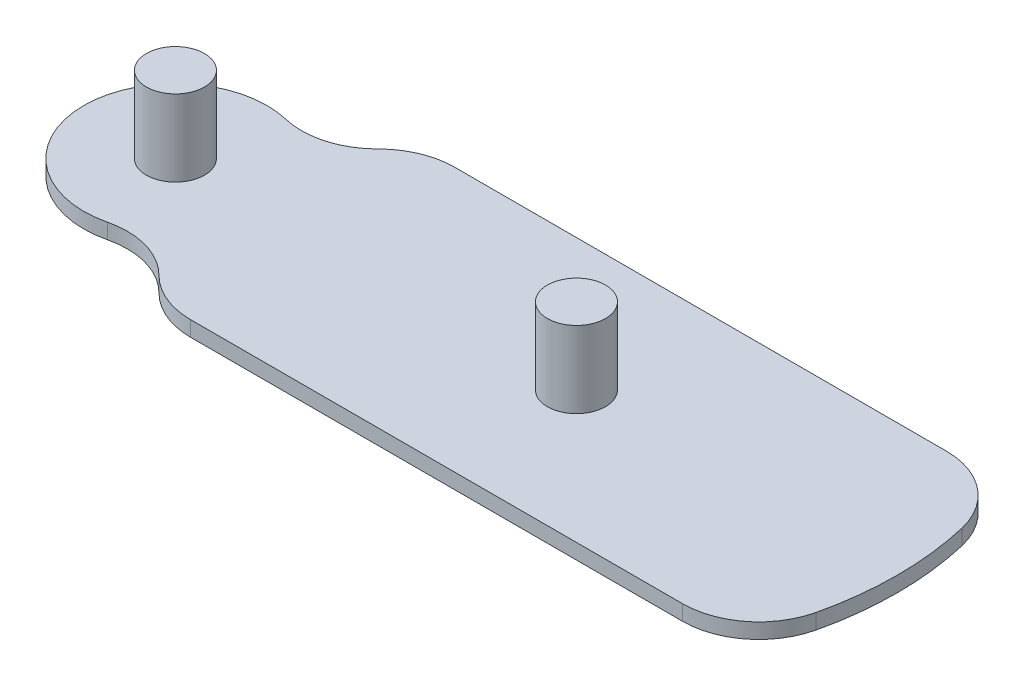
from build123d import *

# Parameters (mm, degrees)
SKETCH1_R           = 12
SKETCH1_R_2         = 42
BOSS_EXTRUDE1_DEPTH = 2
SKETCH2_R           = 3.8
BOSS_EXTRUDE2_DEPTH = 10
FILLET1_R           = 10
CUT_EXTRUDE1_START  = -10
CUT_EXTRUDE1_DEPTH  = 10
FILLET2_R           = 10


with BuildPart() as part:
    # Sketch1 → Boss-Extrude1 (new body)
    with BuildSketch(Plane(origin=(0, 0, 0), x_dir=(1, 0, 0), z_dir=(0, 1, 0))):
        Circle(SKETCH1_R)
        with Locations((52.5, 0)):
            Circle(SKETCH1_R_2)
    extrude(amount=BOSS_EXTRUDE1_DEPTH)

    # Sketch2 → Boss-Extrude2 (add)
    with BuildSketch(Plane(origin=(0, 2, 0), x_dir=(1, 0, 0), z_dir=(0, 1, 0))):
        with Locations(Location((0, 0, 0), (0, 0, 270))):
            Circle(SKETCH2_R)
        with Locations(Location((52.5, 0, 0), (0, 0, 270))):
            Circle(SKETCH2_R)
    extrude(amount=BOSS_EXTRUDE2_DEPTH)

    # Fillet1
    fillet1_edges = [part.edges().sort_by_distance(p)[0] for p in [
        (10.821428571, 1, 5.186201276),
        (10.821428571, 1, -5.186201276),
    ]]
    fillet(fillet1_edges, radius=FILLET1_R)

    # Sketch3 → Cut-Extrude1 (cut)
    with BuildSketch(Plane(origin=(0, 2, 0), x_dir=(1, 0, 0), z_dir=(0, 1, 0)).offset(CUT_EXTRUDE1_START)):
        with BuildLine():
            Line((14.221153846, -17.283805632), (90.778846154, -17.283805632))
            ThreePointArc((90.778846154, -17.283805632), (52.5, -42), (14.221153846, -17.283805632))
        make_face()
        with BuildLine():
            Line((14.221153846, 17.283805632), (90.778846154, 17.283805632))
            ThreePointArc((90.778846154, 17.283805632), (52.5, 42), (14.221153846, 17.283805632))
        make_face()
    extrude(amount=CUT_EXTRUDE1_DEPTH, mode=Mode.SUBTRACT)

    # Fillet2
    fillet2_edges = [part.edges().sort_by_distance(p)[0] for p in [
        (14.221153846, 1, 17.283805632),
        (14.221153846, 1, -17.283805632),
        (90.778846154, 1, 17.283805632),
        (90.778846154, 1, -17.283805632),
    ]]
    fillet(fillet2_edges, radius=FILLET2_R)


solid = part.part
